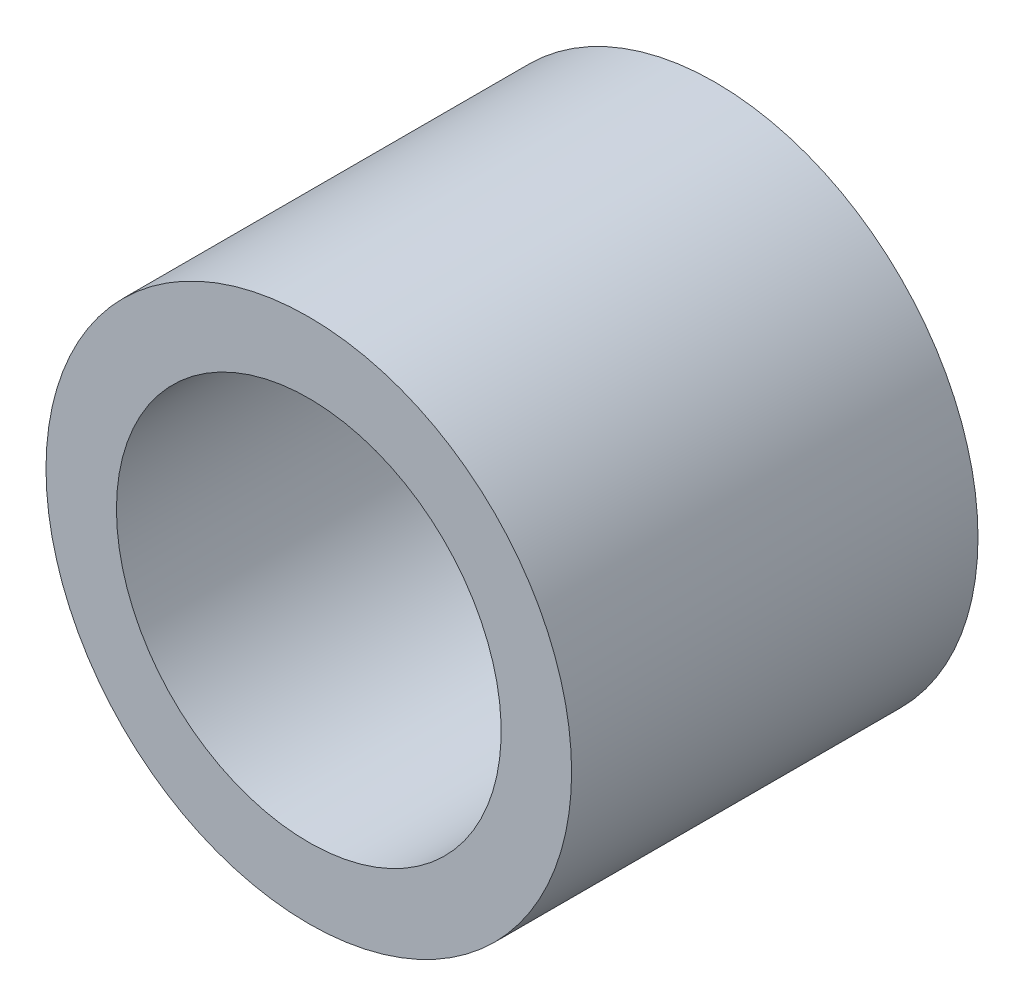
from build123d import *

# Parameters (mm, degrees)
SKETCH1_R           = 12.319
SKETCH1_R_2         = 9.017
BOSS_EXTRUDE1_DEPTH = 19.05


with BuildPart() as part:
    # Sketch1 → Boss-Extrude1 (new body)
    with BuildSketch(Plane.XY):
        Circle(SKETCH1_R)
        Circle(SKETCH1_R_2, mode=Mode.SUBTRACT)
    extrude(amount=BOSS_EXTRUDE1_DEPTH)


solid = part.part
